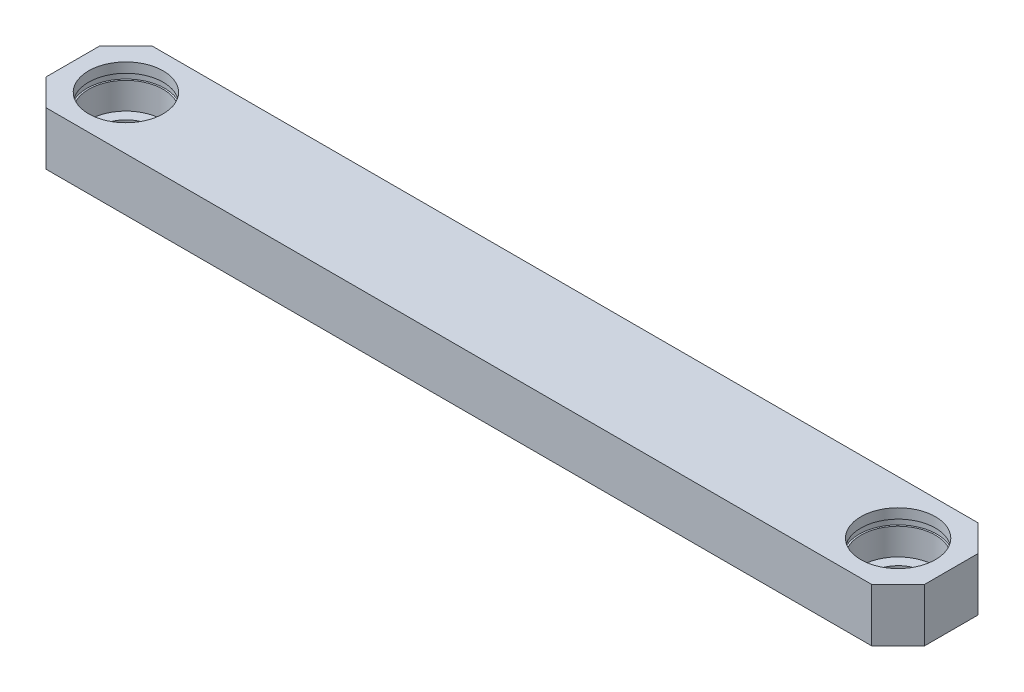
from build123d import *

# Parameters (mm, degrees)
SKETCH1_W           = 165
SKETCH1_H           = 20
BOSS_EXTRUDE1_DEPTH = 10
CHAMFER1_SIZE       = 5


with BuildPart() as part:
    # Sketch1 → Boss-Extrude1 (new body)
    with BuildSketch(Plane(origin=(0, 0, 0), x_dir=(1, 0, 0), z_dir=(0, 1, 0))):
        with Locations((82.5, 0)):
            Rectangle(SKETCH1_W, SKETCH1_H)
    extrude(amount=BOSS_EXTRUDE1_DEPTH)

    # Chamfer1
    chamfer1_edges = [part.edges().sort_by_distance(p)[0] for p in [
        (0, 5, -10),
        (165, 5, -10),
        (165, 5, 10),
        (0, 5, 10),
    ]]
    chamfer(chamfer1_edges, length=CHAMFER1_SIZE)

    # Sketch2 → Cut-Revolve1 (revolve, cut)
    with BuildSketch(Plane.XY):
        Polygon((2.7, 7), (3, 7), (3, 2), (5, 2), (5, 0), (10, 0), (10, 10), (3, 10), (3, 8.15), (2.7, 8.15), align=None)
    revolve(axis=Axis((10, 10, 0), (0, -1, 0)), mode=Mode.SUBTRACT)

    # Sketch7 → Cut-Revolve2 (revolve, cut)
    with BuildSketch(Plane.XY, mode=Mode.PRIVATE) as cut_revolve2_sk:
        Polygon((148, 10), (148, 8.15), (147.7, 8.15), (147.7, 7), (148, 7), (148, 2), (150, 2), (150, 0), (155, 0), (155, 10), align=None)
    revolve(cut_revolve2_sk.sketch.rotate(Axis((155, 10, 0), (0, -1, 0)), 270), axis=Axis((155, 10, 0), (0, -1, 0)), mode=Mode.SUBTRACT)


solid = part.part
